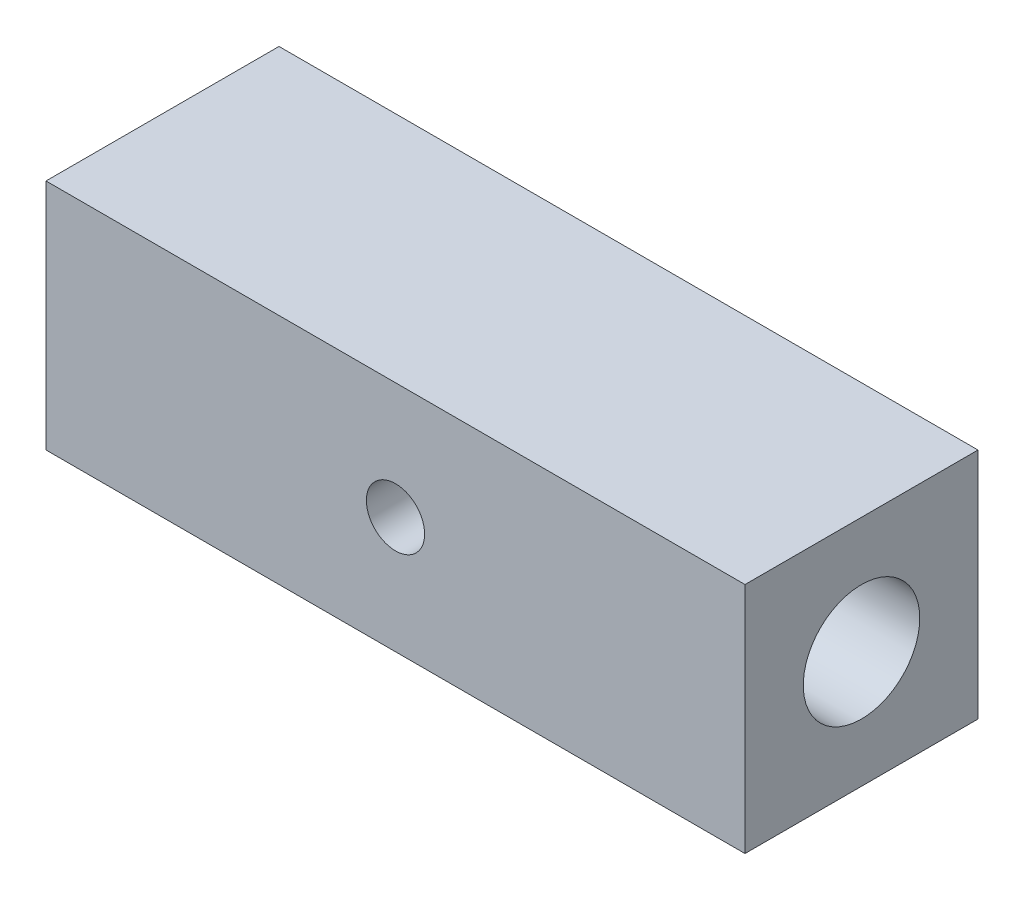
from build123d import *

# Parameters (mm, degrees)
SKETCH1_W           = 76.2
SKETCH1_H           = 25.4
SKETCH1_R           = 3.175
BOSS_EXTRUDE1_DEPTH = 25.4
SKETCH2_R           = 6.35
CUT_EXTRUDE1_DEPTH  = 85.242269675


with BuildPart() as part:
    # Sketch1 → Boss-Extrude1 (new body)
    with BuildSketch(Plane.XY):
        with Locations((-38.1, 12.7)):
            Rectangle(SKETCH1_W, SKETCH1_H)
        with Locations((-38.1, 12.7)):
            Circle(SKETCH1_R, mode=Mode.SUBTRACT)
    extrude(amount=BOSS_EXTRUDE1_DEPTH)

    # Sketch2 → Cut-Extrude1 (cut, through all)
    with BuildSketch(Plane(origin=(0, 0, 0), x_dir=(0, 0, -1), z_dir=(1, 0, 0))):
        with Locations((-12.7, 12.7)):
            Circle(SKETCH2_R)
    extrude(amount=-CUT_EXTRUDE1_DEPTH, mode=Mode.SUBTRACT)


solid = part.part
